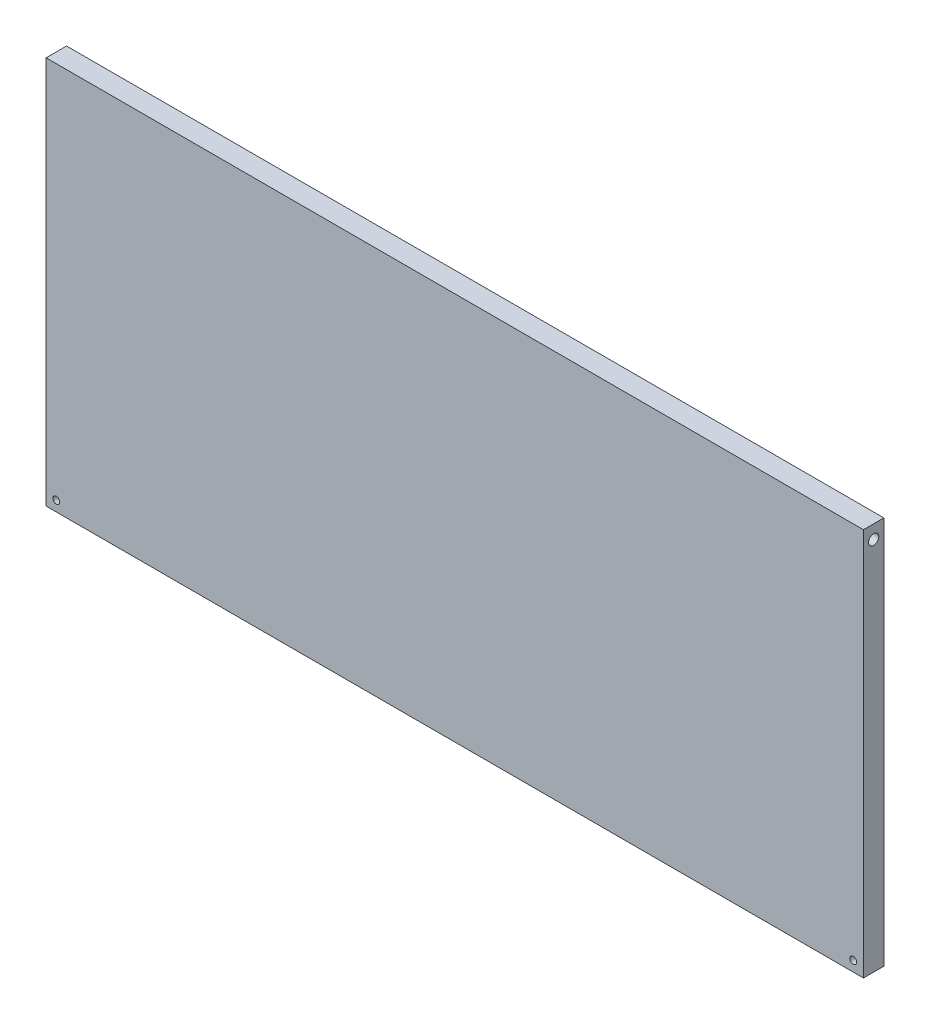
from build123d import *

# Parameters (mm, degrees)
SKETCH_1_W          = 120
SKETCH_1_H          = 57
EXTRUDE_1_DEPTH     = 3
SKETCH_2_R          = 0.75
CUT_EXTRUDE_1_DEPTH = 124
SKETCH_3_R          = 0.5
CUT_EXTRUDE_2_DEPTH = 10


with BuildPart() as part:
    # 草图1 → 凸台-拉伸1 (new body)
    with BuildSketch(Plane.XY):
        with Locations((60, 28.5)):
            Rectangle(SKETCH_1_W, SKETCH_1_H)
    extrude(amount=EXTRUDE_1_DEPTH)

    # 草图2 → 切除-拉伸1 (cut)
    with BuildSketch(Plane(origin=(120, 0, 0), x_dir=(0, 0, -1), z_dir=(1, 0, 0))):
        with Locations((-1.5, 55)):
            Circle(SKETCH_2_R)
    extrude(amount=-CUT_EXTRUDE_1_DEPTH, mode=Mode.SUBTRACT)

    # 草图3 → 切除-拉伸2 (cut)
    with BuildSketch(Plane.XY.offset(3)):
        with Locations((1.5, 1.5)):
            Circle(SKETCH_3_R)
        with Locations((118.5, 1.5)):
            Circle(SKETCH_3_R)
    extrude(amount=-CUT_EXTRUDE_2_DEPTH, mode=Mode.SUBTRACT)


solid = part.part
